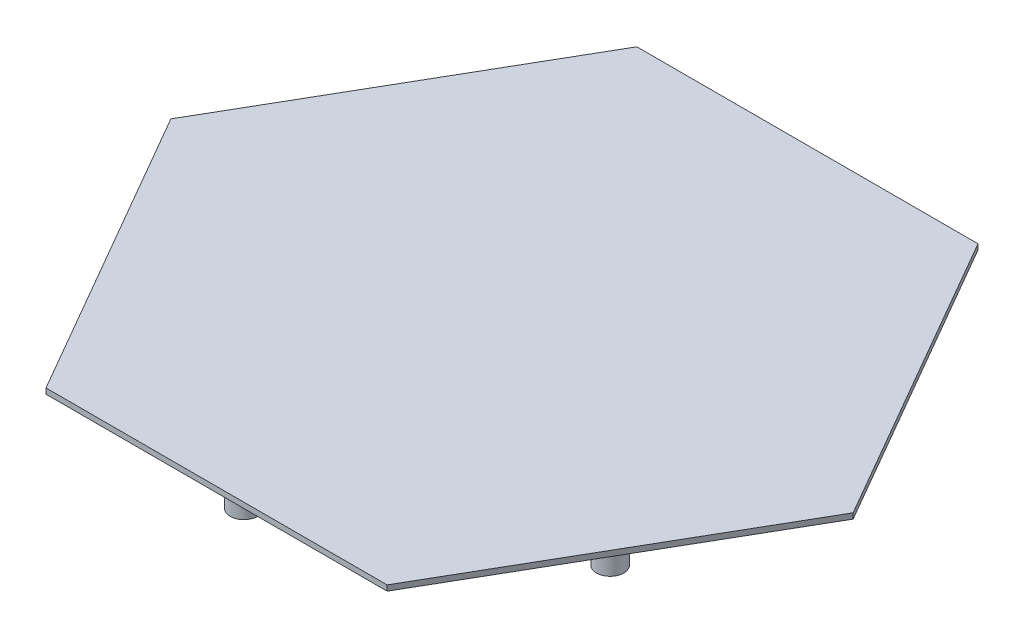
from build123d import *

# Parameters (mm, degrees)
SKETCH1_R             = 2.5
BOSS_EXTRUDE1_DEPTH   = 5
BOSS_EXTRUDE1_2_DEPTH = 5
BOSS_EXTRUDE1_3_DEPTH = 5
BOSS_EXTRUDE1_4_DEPTH = 5
BOSS_EXTRUDE1_5_DEPTH = 5
BOSS_EXTRUDE1_6_DEPTH = 5
BOSS_EXTRUDE2_DEPTH   = 1


with BuildPart() as part:
    # Sketch1 → Boss-Extrude1 (new body)
    with BuildSketch(Plane(origin=(0, 10, 0), x_dir=(1, 0, 0), z_dir=(0, 1, 0))):
        with Locations(Location((0, 49, 0), (0, 0, 270))):
            Circle(SKETCH1_R)
    extrude(amount=BOSS_EXTRUDE1_DEPTH)



with BuildPart() as body_2:
    # Sketch1 → Boss-Extrude1 2 (new body)
    with BuildSketch(Plane(origin=(0, 10, 0), x_dir=(1, 0, 0), z_dir=(0, 1, 0))):
        with Locations(Location((42.435244785, 24.5, 0), (0, 0, 270))):
            Circle(SKETCH1_R)
    extrude(amount=BOSS_EXTRUDE1_2_DEPTH)


with BuildPart() as body_3:
    # Sketch1 → Boss-Extrude1 3 (new body)
    with BuildSketch(Plane(origin=(0, 10, 0), x_dir=(1, 0, 0), z_dir=(0, 1, 0))):
        with Locations(Location((42.435244785, -24.5, 0), (0, 0, 270))):
            Circle(SKETCH1_R)
    extrude(amount=BOSS_EXTRUDE1_3_DEPTH)


with BuildPart() as body_4:
    # Sketch1 → Boss-Extrude1 4 (new body)
    with BuildSketch(Plane(origin=(0, 10, 0), x_dir=(1, 0, 0), z_dir=(0, 1, 0))):
        with Locations(Location((0, -49, 0), (0, 0, 270))):
            Circle(SKETCH1_R)
    extrude(amount=BOSS_EXTRUDE1_4_DEPTH)


with BuildPart() as body_5:
    # Sketch1 → Boss-Extrude1 5 (new body)
    with BuildSketch(Plane(origin=(0, 10, 0), x_dir=(1, 0, 0), z_dir=(0, 1, 0))):
        with Locations(Location((-42.435244785, -24.5, 0), (0, 0, 270))):
            Circle(SKETCH1_R)
    extrude(amount=BOSS_EXTRUDE1_5_DEPTH)


with BuildPart() as body_6:
    # Sketch1 → Boss-Extrude1 6 (new body)
    with BuildSketch(Plane(origin=(0, 10, 0), x_dir=(1, 0, 0), z_dir=(0, 1, 0))):
        with Locations(Location((-42.435244785, 24.5, 0), (0, 0, 270))):
            Circle(SKETCH1_R)
    extrude(amount=BOSS_EXTRUDE1_6_DEPTH)


with BuildPart() as part_1:
    add(part.part)

    add(body_2.part)  # Boss-Extrude2 merges body 2

    add(body_3.part)  # Boss-Extrude2 merges body 3

    add(body_4.part)  # Boss-Extrude2 merges body 4

    add(body_5.part)  # Boss-Extrude2 merges body 5

    add(body_6.part)  # Boss-Extrude2 merges body 6
    # Sketch2 → Boss-Extrude2 (add)
    with BuildSketch(Plane(origin=(0, 15, 0), x_dir=(1, 0, 0), z_dir=(0, 1, 0))):
        Polygon((62.353829072, 0), (31.176914536, 54), (-31.176914536, 54), (-62.353829072, 0), (-31.176914536, -54), (31.176914536, -54), align=None)
    extrude(amount=BOSS_EXTRUDE2_DEPTH)


solid = part_1.part
